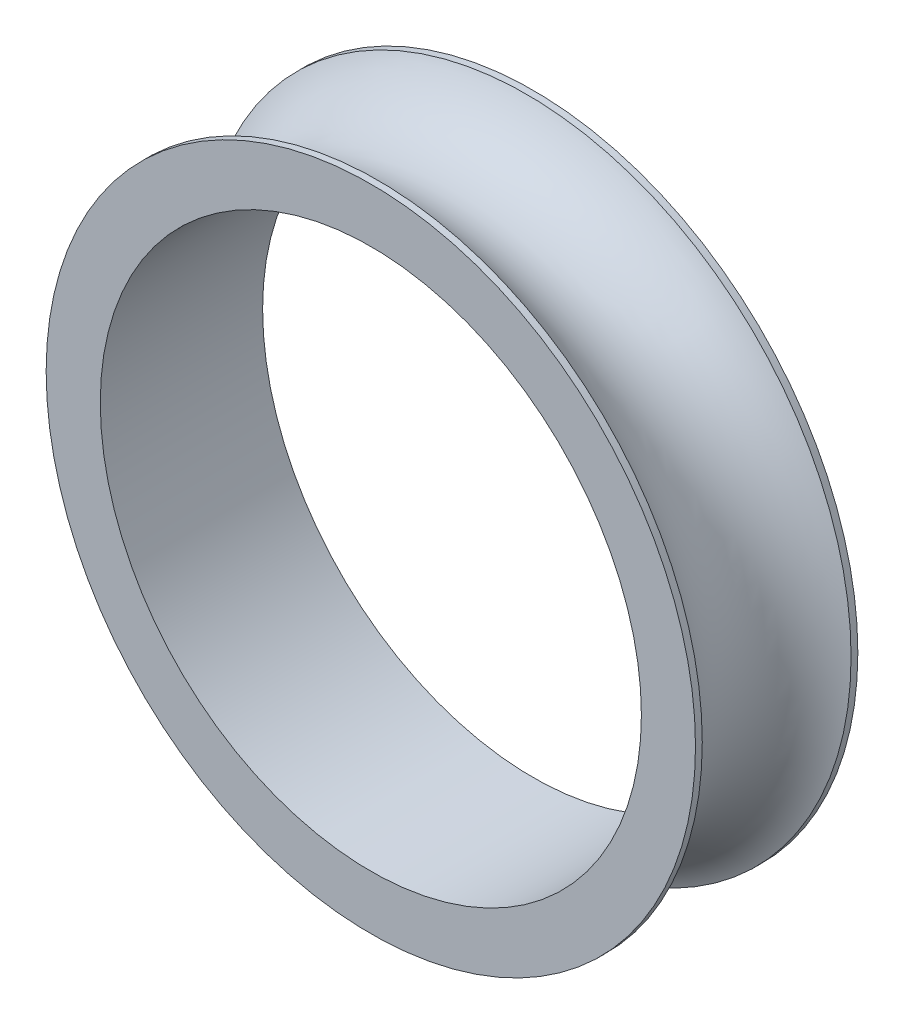
from build123d import *

# Parameters (mm, degrees)
SKETCH1_R           = 30
SKETCH1_R_2         = 25
BOSS_EXTRUDE1_DEPTH = 15
SKETCH2_R           = 7.5
SCALE1_SCALE        = 1.9329
SCALE2_SCALE        = 1.5


with BuildPart() as part:
    # Sketch1 → Boss-Extrude1 (new body)
    with BuildSketch(Plane.XY):
        Circle(SKETCH1_R)
        Circle(SKETCH1_R_2, mode=Mode.SUBTRACT)
    extrude(amount=BOSS_EXTRUDE1_DEPTH)

    # Sketch2 → Cut-Revolve1 (revolve, cut)
    with BuildSketch(Plane(origin=(0, 0, 0), x_dir=(0, 0, -1), z_dir=(1, 0, 0)), mode=Mode.PRIVATE) as cut_revolve1_sk:
        with Locations((-7.5, 33)):
            Circle(SKETCH2_R)
    revolve(cut_revolve1_sk.sketch.rotate(Axis((0, 0, 25.257665056), (0, 0, -1)), 90), axis=Axis((0, 0, 25.257665056), (0, 0, -1)), mode=Mode.SUBTRACT)


with BuildPart() as part_1:
    # Scale1: scaled about (0, 0, 7.5)
    add(part.part.scale(SCALE1_SCALE).moved(Location((0, 0, -6.99675))))


with BuildPart() as part_2:
    # Scale2: scaled about (0, 0, 7.5)
    add(part_1.part.scale(SCALE2_SCALE).moved(Location((0, 0, -3.75))))


solid = part_2.part
